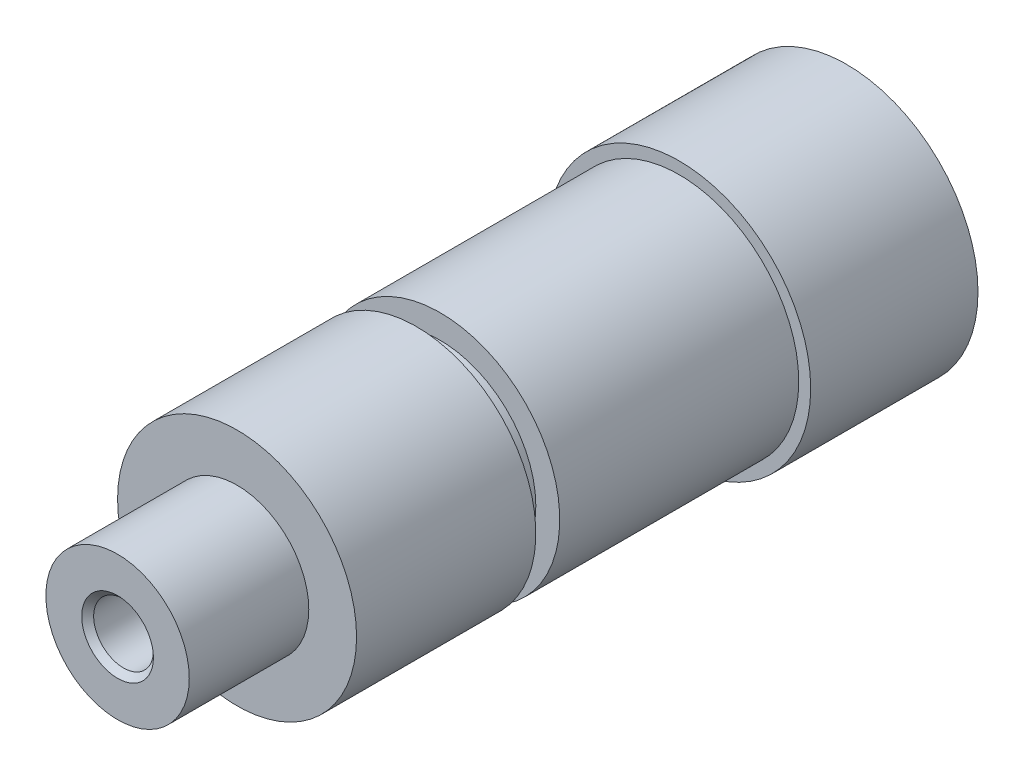
from build123d import *

# Parameters (mm, degrees)
ESQUISSE1_R                     = 11
BASE_EXTRUSION_DEPTH            = 14
ESQUISSE2_R                     = 10
BOSS_EXTRU_1_DEPTH              = 37
ESQUISSE3_W                     = 2
ESQUISSE3_H                     = 2
ESQUISSE4_R                     = 6
BOSS_EXTRU_2_DEPTH              = 10
TROU_TARAUD_M6X1_01_D           = 5
TROU_TARAUD_M6X1_01_DEPTH       = 19
TROU_TARAUD_M6X1_01_CSINK_D     = 6
TROU_TARAUD_M6X1_01_CSINK_ANGLE = 90
TROU_TARAUD_M6X1_01_TIP         = 1.502151548


with BuildPart() as part:
    # Esquisse1 → Base-Extrusion (new body)
    with BuildSketch(Plane.XY):
        Circle(ESQUISSE1_R)
    extrude(amount=BASE_EXTRUSION_DEPTH)

    # Esquisse2 → Boss.-Extru.1 (add)
    with BuildSketch(Plane.XY.offset(14)):
        Circle(ESQUISSE2_R)
    extrude(amount=BOSS_EXTRU_1_DEPTH)

    # Esquisse3 → Enlèvement de matière-Révolution1 (revolve, cut)
    with BuildSketch(Plane(origin=(0, 0, 0), x_dir=(1, 0, 0), z_dir=(0, 1, 0)), mode=Mode.PRIVATE) as enl_vement_de_mati_re_r_volution1_sk:
        with Locations((9, -35)):
            Rectangle(ESQUISSE3_W, ESQUISSE3_H)
    revolve(enl_vement_de_mati_re_r_volution1_sk.sketch.rotate(Axis((0, 0, 0), (0, 0, 1)), 180), axis=Axis((0, 0, 0), (0, 0, 1)), mode=Mode.SUBTRACT)

    # Esquisse4 → Boss.-Extru.2 (add)
    with BuildSketch(Plane.XY.offset(51)):
        Circle(ESQUISSE4_R)
    extrude(amount=BOSS_EXTRU_2_DEPTH)

    # Trou taraudé M6x1.01
    with Locations(Plane.XY.offset(61)):
        with Locations((0, 0)):
            CounterSinkHole(TROU_TARAUD_M6X1_01_D / 2, TROU_TARAUD_M6X1_01_CSINK_D / 2, depth=TROU_TARAUD_M6X1_01_DEPTH, counter_sink_angle=TROU_TARAUD_M6X1_01_CSINK_ANGLE)
            with Locations((0, 0, -(TROU_TARAUD_M6X1_01_DEPTH + TROU_TARAUD_M6X1_01_TIP / 2))):  # 118° drill point
                Cone(0, TROU_TARAUD_M6X1_01_D / 2, TROU_TARAUD_M6X1_01_TIP, mode=Mode.SUBTRACT)


solid = part.part
